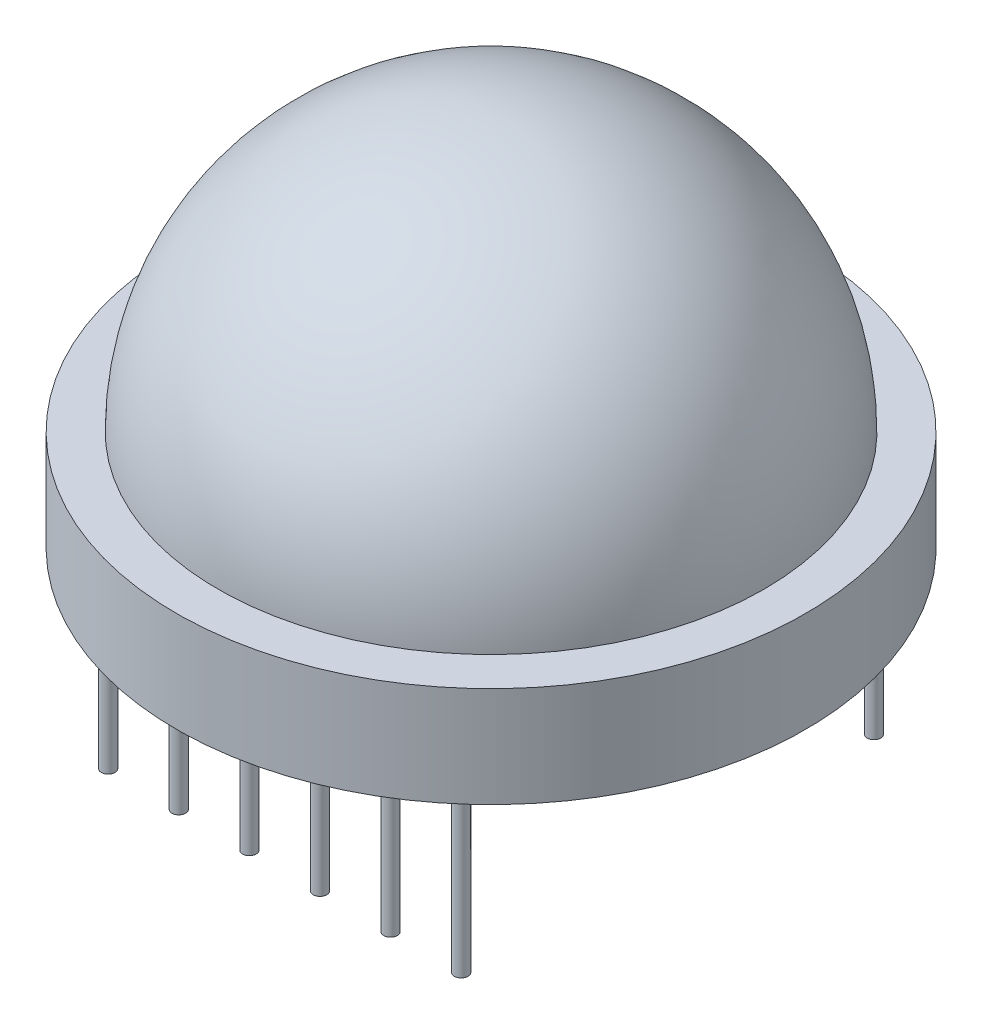
from build123d import *

# Parameters (mm, degrees)
SKETCH2_R           = 0.25
BOSS_EXTRUDE1_DEPTH = 6.5


with BuildPart() as part:
    # Sketch1 → Revolve1 (revolve)
    with BuildSketch(Plane.XY):
        with BuildLine():
            Line((0, 10.055), (0, 0))
            Line((0, 0), (0, -3.7))
            Line((0, -3.7), (-11.595, -3.7))
            Line((-11.595, -3.7), (-11.595, 0))
            Line((-11.595, 0), (-10.055, 0))
            ThreePointArc((-10.055, 0), (-7.109958685, 7.109958685), (0, 10.055))
        make_face()
    revolve(axis=Axis((0, 10.055, 0), (0, -1, 0)))

    # Sketch2 → Boss-Extrude1 (add)
    with BuildSketch(Plane.XZ.offset(3.7)):
        with Locations((-6.505, 7.605)):
            Circle(SKETCH2_R)
        with Locations((-3.903, 7.605)):
            Circle(SKETCH2_R)
        with Locations((-1.301, 7.605)):
            Circle(SKETCH2_R)
        with Locations((1.301, 7.605)):
            Circle(SKETCH2_R)
        with Locations((3.903, 7.605)):
            Circle(SKETCH2_R)
        with Locations((6.505, 7.605)):
            Circle(SKETCH2_R)
        with Locations((-3.903, -7.605)):
            Circle(SKETCH2_R)
        with Locations((-1.301, -7.605)):
            Circle(SKETCH2_R)
        with Locations((1.301, -7.605)):
            Circle(SKETCH2_R)
        with Locations((3.903, -7.605)):
            Circle(SKETCH2_R)
        with Locations((6.505, -7.605)):
            Circle(SKETCH2_R)
        with Locations((-6.505, -7.605)):
            Circle(SKETCH2_R)
    extrude(amount=BOSS_EXTRUDE1_DEPTH)


solid = part.part
